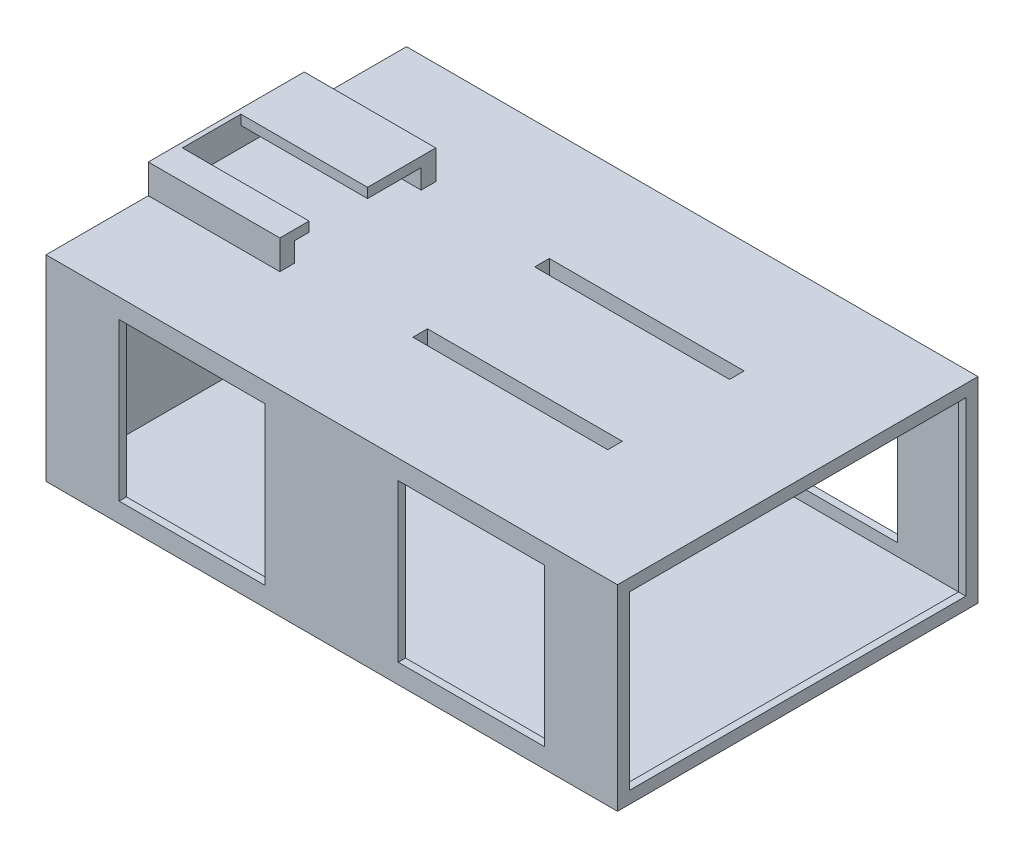
from build123d import *

# Parameters (mm, degrees)
SKETCH1_W            = 117.3
SKETCH1_H            = 74
SKETCH1_W_2          = 114.3
SKETCH1_H_2          = 71
BOSS_EXTRUDE1_DEPTH  = 40.28
SKETCH5_W            = 117.3
SKETCH5_H            = 74
BOSS_EXTRUDE3_DEPTH  = 1.5
SKETCH7_W            = 69
SKETCH7_H            = 35.28
CUT_EXTRUDE3_DEPTH   = 2
SKETCH8_W            = 117.3
SKETCH8_H            = 74
BOSS_EXTRUDE4_DEPTH  = 1.5
SKETCH9_W            = 26
SKETCH9_H            = 3
BOSS_EXTRUDE5_DEPTH  = 6
SKETCH10_W           = 26
SKETCH10_H           = 2
BOSS_EXTRUDE6_DEPTH  = 11
SKETCH11_W           = 26
SKETCH11_H           = 2
BOSS_EXTRUDE7_DEPTH  = 3
SKETCH12_W           = 32
SKETCH12_H           = 6
BOSS_EXTRUDE8_DEPTH  = 1
SKETCH19_W           = 30
SKETCH19_H           = 32.28
CUT_EXTRUDE6_DEPTH   = 147.209193965
SKETCH20_W           = 55
SKETCH20_H           = 35
BOSS_EXTRUDE10_DEPTH = 13.5
SKETCH22_W           = 40
SKETCH22_H           = 3
CUT_EXTRUDE7_DEPTH   = 141.976481727


with BuildPart() as part:
    # Sketch1 → Boss-Extrude1 (new body)
    with BuildSketch(Plane(origin=(0, 0, 0), x_dir=(1, 0, 0), z_dir=(0, 1, 0))):
        with Locations((58.65, 37)):
            Rectangle(SKETCH1_W, SKETCH1_H)
        with Locations((58.65, 37)):
            Rectangle(SKETCH1_W_2, SKETCH1_H_2, mode=Mode.SUBTRACT)
    extrude(amount=BOSS_EXTRUDE1_DEPTH)

    # Sketch5 → Boss-Extrude3 (add)
    with BuildSketch(Plane.XZ):
        with Locations((58.65, -37)):
            Rectangle(SKETCH5_W, SKETCH5_H)
    extrude(amount=-BOSS_EXTRUDE3_DEPTH)

    # Sketch7 → Cut-Extrude3 (cut)
    with BuildSketch(Plane(origin=(117.3, 0, 0), x_dir=(0, 0, -1), z_dir=(1, 0, 0))):
        with Locations((37, 20.14)):
            Rectangle(SKETCH7_W, SKETCH7_H)
    extrude(amount=-CUT_EXTRUDE3_DEPTH, mode=Mode.SUBTRACT)

    # Sketch8 → Boss-Extrude4 (add)
    with BuildSketch(Plane(origin=(0, 40.28, 0), x_dir=(1, 0, 0), z_dir=(0, 1, 0))):
        with Locations((58.65, 37)):
            Rectangle(SKETCH8_W, SKETCH8_H)
    extrude(amount=-BOSS_EXTRUDE4_DEPTH)

    # Sketch9 → Boss-Extrude5 (add)
    with BuildSketch(Plane(origin=(0, 40.28, 0), x_dir=(1, 0, 0), z_dir=(0, 1, 0))):
        with Locations((14, 51.5)):
            Rectangle(SKETCH9_W, SKETCH9_H)
        with Locations((14, 22.5)):
            Rectangle(SKETCH9_W, SKETCH9_H)
    extrude(amount=BOSS_EXTRUDE5_DEPTH)

    # Sketch10 → Boss-Extrude6 (add)
    with BuildSketch(Plane.XY.offset(-50)):
        with Locations((14, 45.28)):
            Rectangle(SKETCH10_W, SKETCH10_H)
    extrude(amount=BOSS_EXTRUDE6_DEPTH)

    # Sketch11 → Boss-Extrude7 (add)
    with BuildSketch(Plane(origin=(0, 0, -24), x_dir=(-1, 0, 0), z_dir=(0, 0, -1))):
        with Locations((-14, 45.28)):
            Rectangle(SKETCH11_W, SKETCH11_H)
    extrude(amount=BOSS_EXTRUDE7_DEPTH)

    # Sketch12 → Boss-Extrude8 (add)
    with BuildSketch(Plane.ZY.offset(-1)):
        with Locations((-37, 43.28)):
            Rectangle(SKETCH12_W, SKETCH12_H)
    extrude(amount=BOSS_EXTRUDE8_DEPTH)

    # Sketch19 → Cut-Extrude6 (cut, through all)
    with BuildSketch(Plane.XY):
        with Locations((30, 20.14)):
            Rectangle(SKETCH19_W, SKETCH19_H)
        with Locations((87.3, 20.14)):
            Rectangle(SKETCH19_W, SKETCH19_H)
    extrude(amount=-CUT_EXTRUDE6_DEPTH, mode=Mode.SUBTRACT)

    # Sketch20 → Boss-Extrude10 (add)
    with BuildSketch(Plane.XZ.offset(-38.78)):
        with Locations((74.8, -37)):
            Rectangle(SKETCH20_W, SKETCH20_H)
    extrude(amount=BOSS_EXTRUDE10_DEPTH)

    # Sketch22 → Cut-Extrude7 (cut, through all)
    with BuildSketch(Plane.XZ.offset(-25.28)):
        with Locations((72.3, -24.5)):
            Rectangle(SKETCH22_W, SKETCH22_H)
        with Locations((72.3, -49.5)):
            Rectangle(SKETCH22_W, SKETCH22_H)
    extrude(amount=-CUT_EXTRUDE7_DEPTH, mode=Mode.SUBTRACT)


solid = part.part
